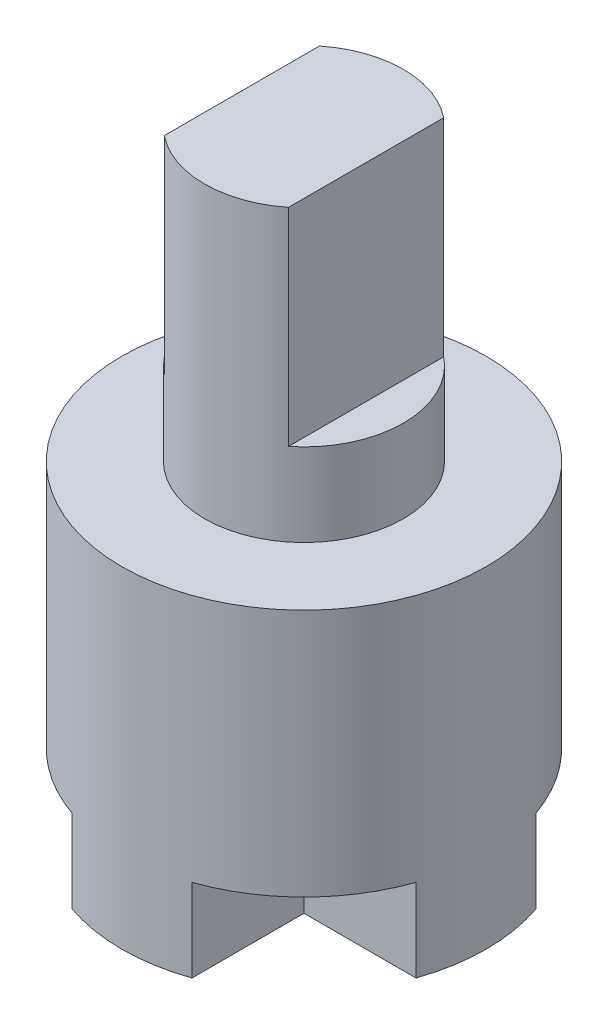
from build123d import *
from build123d.topology import SkipClean

# Parameters (mm, degrees)
SKETCH1_R           = 4.4
BOSS_EXTRUDE1_DEPTH = 6
SKETCH2_R           = 2.4
BOSS_EXTRUDE2_DEPTH = 2
BOSS_EXTRUDE3_DEPTH = 5
BOSS_EXTRUDE4_START = 2
SKETCH4_W           = 2.9
SKETCH4_H           = 2.9
BOSS_EXTRUDE4_DEPTH = 2


with BuildPart() as part:
    # Sketch1 → Boss-Extrude1 (new body)
    with BuildSketch(Plane(origin=(0, 0, 0), x_dir=(1, 0, 0), z_dir=(0, 1, 0))):
        with Locations(Location((0, 0, 0), (0, 0, 270))):
            Circle(SKETCH1_R)
    extrude(amount=BOSS_EXTRUDE1_DEPTH)

    # Sketch2 → Boss-Extrude2 (add)
    with BuildSketch(Plane(origin=(0, 6, 0), x_dir=(1, 0, 0), z_dir=(0, 1, 0))):
        with Locations(Location((0, 0, 0), (0, 0, 270))):
            Circle(SKETCH2_R)
    extrude(amount=BOSS_EXTRUDE2_DEPTH)

    # Sketch3 → Boss-Extrude3 (add)
    with BuildSketch(Plane(origin=(0, 8, 0), x_dir=(1, 0, 0), z_dir=(0, 1, 0))):
        with BuildLine():
            Line((-1.5, 1.8734994), (-1.5, -1.8734994))
            ThreePointArc((-1.5, -1.8734994), (0, -2.4), (1.5, -1.8734994))
            Line((1.5, -1.8734994), (1.5, 1.8734994))
            ThreePointArc((1.5, 1.8734994), (0, 2.4), (-1.5, 1.8734994))
        make_face()
    extrude(amount=BOSS_EXTRUDE3_DEPTH)

    # Sketch4 → Boss-Extrude4 (add)
    with SkipClean():  # the faces are left unmerged after this step: merging them gives an invalid solid
        with BuildSketch(Plane.XZ.offset(BOSS_EXTRUDE4_START)):
            with BuildLine():
                Line((1.45, -1.45), (-1.45, -1.45))
                Line((-1.45, -1.45), (-1.45, -4.154214727))
                ThreePointArc((-1.45, -4.154214727), (0, -4.4), (1.45, -4.154214727))
                Line((1.45, -4.154214727), (1.45, -1.45))
            make_face()
            Rectangle(SKETCH4_W, SKETCH4_H)
            with BuildLine():
                Line((4.154214727, 1.45), (1.45, 1.45))
                Line((1.45, 1.45), (1.45, -1.45))
                Line((1.45, -1.45), (4.154214727, -1.45))
                ThreePointArc((4.154214727, -1.45), (4.338118532, -0.735341825), (4.4, 0))
                ThreePointArc((4.4, 0), (4.338118532, 0.735341825), (4.154214727, 1.45))
            make_face()
            with BuildLine():
                Line((-1.45, 1.45), (-4.154214727, 1.45))
                ThreePointArc((-4.154214727, 1.45), (-4.4, 0), (-4.154214727, -1.45))
                Line((-4.154214727, -1.45), (-1.45, -1.45))
                Line((-1.45, -1.45), (-1.45, 1.45))
            make_face()
            with BuildLine():
                Line((-1.45, 4.154214727), (-1.45, 1.45))
                Line((-1.45, 1.45), (1.45, 1.45))
                Line((1.45, 1.45), (1.45, 4.154214727))
                ThreePointArc((1.45, 4.154214727), (0, 4.4), (-1.45, 4.154214727))
            make_face()
        extrude(amount=-BOSS_EXTRUDE4_DEPTH)


solid = part.part
